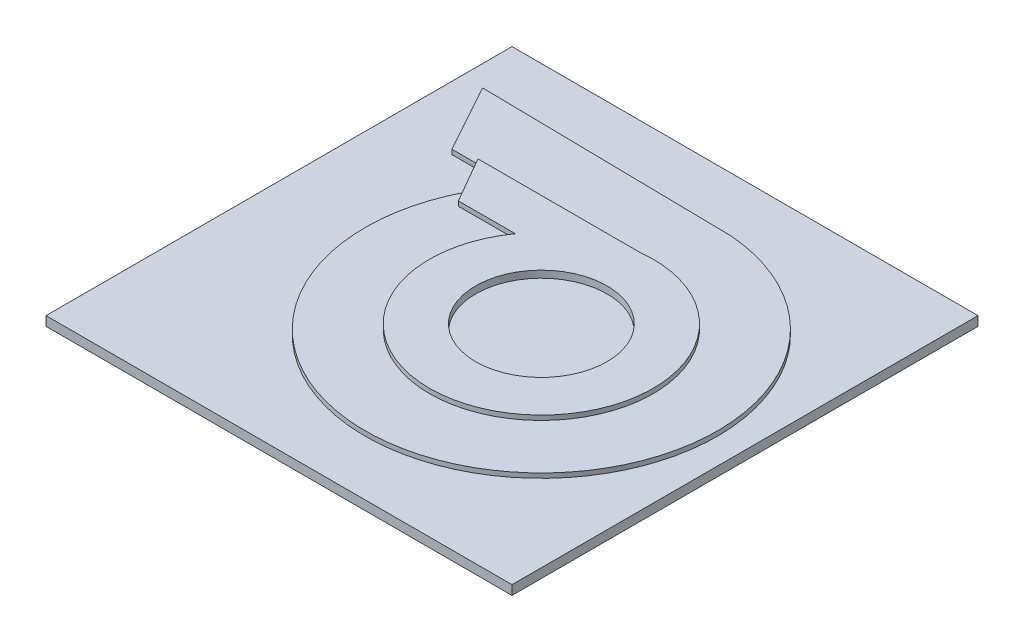
from build123d import *

# Parameters (mm, degrees)
SKETCH1_W           = 100
SKETCH1_H           = 100
BOSS_EXTRUDE1_DEPTH = 2
BOSS_EXTRUDE2_DEPTH = 1
BOSS_EXTRUDE5_DEPTH = 1
SKETCH10_R          = 14.102334265
CUT_EXTRUDE1_DEPTH  = 1.5


with BuildPart() as part:
    # Sketch1 → Boss-Extrude1 (new body)
    with BuildSketch(Plane(origin=(0, 0, 0), x_dir=(1, 0, 0), z_dir=(0, 1, 0))):
        Rectangle(SKETCH1_W, SKETCH1_H)
    extrude(amount=BOSS_EXTRUDE1_DEPTH)

    # Inner Lines Incorrect → Boss-Extrude2 (add)
    with BuildSketch(Plane(origin=(0, 2, 0), x_dir=(-1, 0, 0), z_dir=(0, 1, 0))):
        with BuildLine():
            Line((-9.740714552, -37.307950056), (44.463704926, -38.16254763))
            Line((44.463704926, -38.16254763), (36.373030269, -23.4794714))
            Line((36.373030269, -23.4794714), (30.780994203, -23.4794714))
            Line((30.780994203, -23.4794714), (26.974802478, -16.868717352))
            ThreePointArc((26.974802478, -16.868717352), (-25.050764907, 33.390013397), (-9.740714552, -37.307950056))
        make_face()
    extrude(amount=BOSS_EXTRUDE2_DEPTH)

    # Perfect Trace FT Logo → Boss-Extrude5 (add)
    with BuildSketch(Plane(origin=(0, 3, 0), x_dir=(-1, 0, 0), z_dir=(0, 1, 0))):
        with BuildLine():
            Line((30.780994203, -23.4794714), (25.071735693, -13.56339083))
            Line((25.071735693, -13.56339083), (12.86572713, -13.582342535))
            ThreePointArc((12.86572713, -13.582342535), (-18.847428313, 21.043350665), (-3.934978039, -23.4794714))
            Line((-3.934978039, -23.4794714), (30.780994203, -23.4794714))
        make_face()
    extrude(amount=BOSS_EXTRUDE5_DEPTH)

    # Sketch10 → Cut-Extrude1 (cut)
    with BuildSketch(Plane(origin=(0, 4, 0), x_dir=(1, 0, 0), z_dir=(0, 1, 0))):
        with Locations(Location((6.665815692, -0.364658396, 0), (0, 0, 270))):
            Circle(SKETCH10_R)
    extrude(amount=-CUT_EXTRUDE1_DEPTH, mode=Mode.SUBTRACT)


solid = part.part
